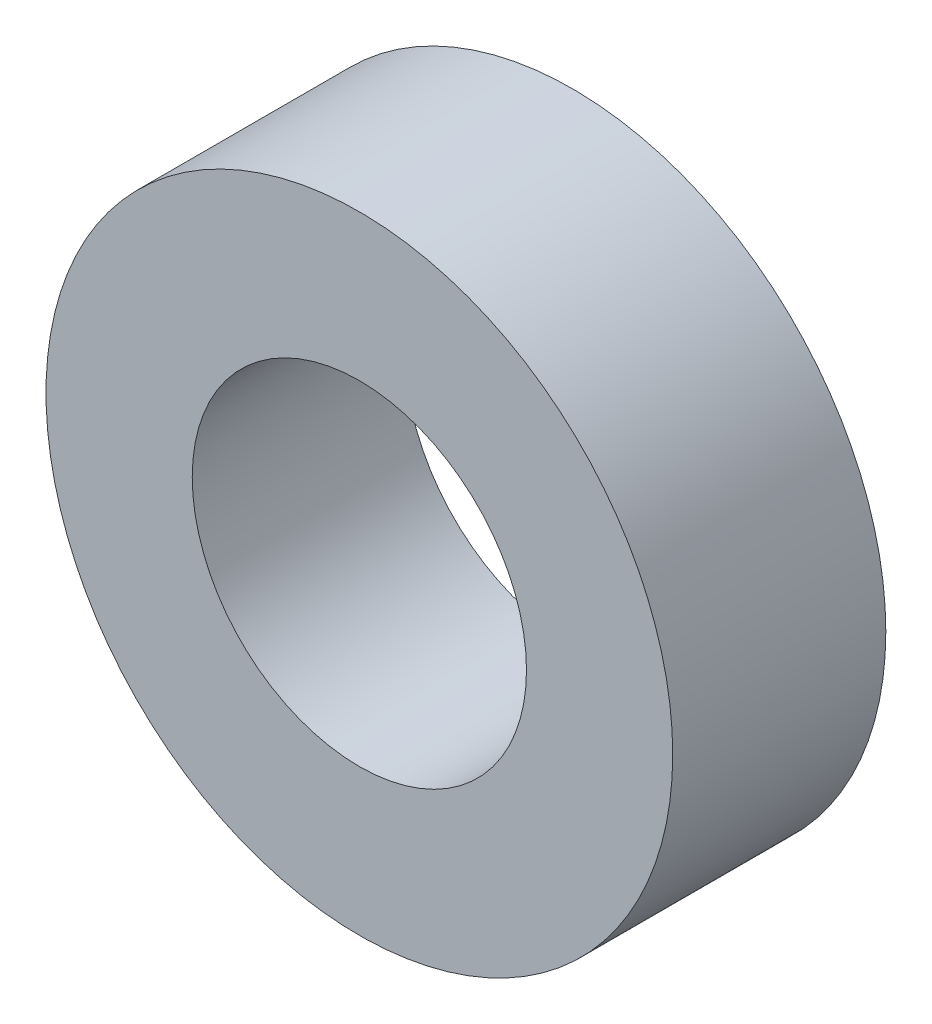
from build123d import *

# Parameters (mm, degrees)
SKETCH1_R           = 7.5
SKETCH1_R_2         = 4
BOSS_EXTRUDE1_DEPTH = 5.1


with BuildPart() as part:
    # Sketch1 → Boss-Extrude1 (new body)
    with BuildSketch(Plane.XY):
        Circle(SKETCH1_R)
        Circle(SKETCH1_R_2, mode=Mode.SUBTRACT)
    extrude(amount=BOSS_EXTRUDE1_DEPTH)


solid = part.part
